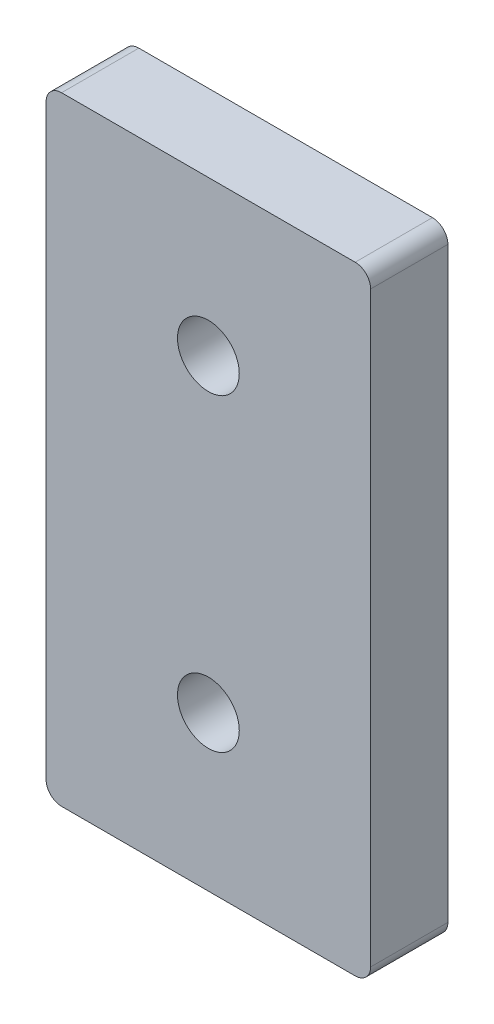
from build123d import *

# Parameters (mm, degrees)
SKETCH1_W           = 21
SKETCH1_H           = 40
SKETCH1_R           = 2
BOSS_EXTRUDE1_DEPTH = 5
FILLET1_R           = 1


with BuildPart() as part:
    # Sketch1 → Boss-Extrude1 (new body)
    with BuildSketch(Plane.XY):
        with Locations((10.5, 20)):
            Rectangle(SKETCH1_W, SKETCH1_H)
        with Locations((10.5, 10)):
            Circle(SKETCH1_R, mode=Mode.SUBTRACT)
        with Locations((10.5, 30)):
            Circle(SKETCH1_R, mode=Mode.SUBTRACT)
    extrude(amount=BOSS_EXTRUDE1_DEPTH)

    # Fillet1
    fillet1_edges = [part.edges().sort_by_distance(p)[0] for p in [
        (0, 40, 2.5),
        (21, 40, 2.5),
        (21, 0, 2.5),
        (0, 0, 2.5),
    ]]
    fillet(fillet1_edges, radius=FILLET1_R)


solid = part.part
